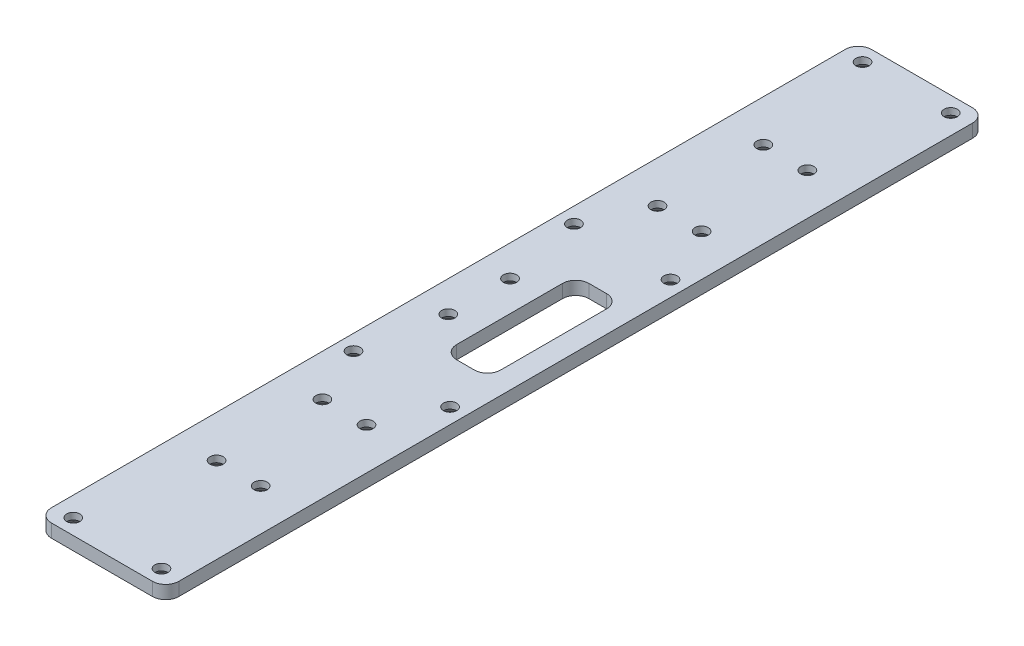
from build123d import *

# Parameters (mm, degrees)
SKETCH_1_W          = 28.9
SKETCH_1_H          = 186
EXTRUDE_1_DEPTH     = 3
FILLET_1_R          = 3
SKETCH_2_R          = 1.5
CUT_EXTRUDE_1_DEPTH = 3
CHAMFER_1_SIZE      = 1.5
SKETCH_3_W          = 10
SKETCH_3_H          = 30
CUT_EXTRUDE_2_DEPTH = 3
FILLET_2_R          = 3


with BuildPart() as part:
    # 草图1 → 凸台-拉伸1 (new body)
    with BuildSketch(Plane(origin=(0, 0, 0), x_dir=(1, 0, 0), z_dir=(0, 1, 0))):
        Rectangle(SKETCH_1_W, SKETCH_1_H)
    extrude(amount=EXTRUDE_1_DEPTH)

    # 圆角1
    fillet_1_edges = [part.edges().sort_by_distance(p)[0] for p in [
        (14.45, 1.5, 93),
        (-14.45, 1.5, 93),
        (-14.45, 1.5, -93),
        (14.45, 1.5, -93),
    ]]
    fillet(fillet_1_edges, radius=FILLET_1_R)

    # 草图2 → 切除-拉伸1 (cut)
    with BuildSketch(Plane(origin=(0, 3, 0), x_dir=(1, 0, 0), z_dir=(0, 1, 0))):
        with Locations(Location((-10, -89.5, 0), (0, 0, 270))):
            Circle(SKETCH_2_R)
        with Locations(Location((10, -89.5, 0), (0, 0, 90))):
            Circle(SKETCH_2_R)
        with Locations(Location((10, 89.5, 0), (0, 0, 270))):
            Circle(SKETCH_2_R)
        with Locations(Location((-10, 89.5, 0), (0, 0, 90))):
            Circle(SKETCH_2_R)
        with Locations(Location((-5, -38, 0), (0, 0, 270))):
            Circle(SKETCH_2_R)
        with Locations(Location((-5, -62, 0), (0, 0, 270))):
            Circle(SKETCH_2_R)
        with Locations(Location((5, -38, 0), (0, 0, 90))):
            Circle(SKETCH_2_R)
        with Locations(Location((5, -62, 0), (0, 0, 90))):
            Circle(SKETCH_2_R)
        with Locations(Location((5, 62, 0), (0, 0, 270))):
            Circle(SKETCH_2_R)
        with Locations(Location((5, 38, 0), (0, 0, 270))):
            Circle(SKETCH_2_R)
        with Locations(Location((-5, 62, 0), (0, 0, 90))):
            Circle(SKETCH_2_R)
        with Locations(Location((-5, 38, 0), (0, 0, 90))):
            Circle(SKETCH_2_R)
        with Locations(Location((-7.45, -7, 0), (0, 0, 270))):
            Circle(SKETCH_2_R)
        with Locations(Location((-7.45, 7, 0), (0, 0, 90))):
            Circle(SKETCH_2_R)
        with Locations(Location((10.95, 25, 0), (0, 0, 270))):
            Circle(SKETCH_2_R)
        with Locations(Location((10.95, -25, 0), (0, 0, 90))):
            Circle(SKETCH_2_R)
        with Locations(Location((-10.95, -25, 0), (0, 0, 270))):
            Circle(SKETCH_2_R)
        with Locations(Location((-10.95, 25, 0), (0, 0, 90))):
            Circle(SKETCH_2_R)
    extrude(amount=-CUT_EXTRUDE_1_DEPTH, mode=Mode.SUBTRACT)

    # 倒角1
    chamfer_1_edges = [part.edges().sort_by_distance(p)[0] for p in [
        (-7.45, 0, 5.5),
        (-5, 0, -36.5),
        (-5, 0, -60.5),
        (5, 0, -39.5),
        (-7.45, 0, -5.5),
        (10.95, 0, -26.5),
        (10.95, 0, 26.5),
        (-10.95, 0, 23.5),
        (10, 0, 91),
        (10, 0, -91),
        (-10, 0, -88),
        (-5, 0, 36.5),
        (5, 0, -63.5),
        (5, 0, 63.5),
        (5, 0, 39.5),
        (-5, 0, 60.5),
        (-10.95, 0, -23.5),
        (-10, 0, 88),
    ]]
    chamfer(chamfer_1_edges, length=CHAMFER_1_SIZE)

    # 草图3 → 切除-拉伸2 (cut)
    with BuildSketch(Plane(origin=(0, 3, 0), x_dir=(1, 0, 0), z_dir=(0, 1, 0))):
        with Locations((4.45, 0)):
            Rectangle(SKETCH_3_W, SKETCH_3_H)
    extrude(amount=-CUT_EXTRUDE_2_DEPTH, mode=Mode.SUBTRACT)

    # 圆角2
    fillet_2_edges = [part.edges().sort_by_distance(p)[0] for p in [
        (9.45, 1.5, -15),
        (9.45, 1.5, 15),
        (-0.55, 1.5, 15),
        (-0.55, 1.5, -15),
    ]]
    fillet(fillet_2_edges, radius=FILLET_2_R)


solid = part.part
